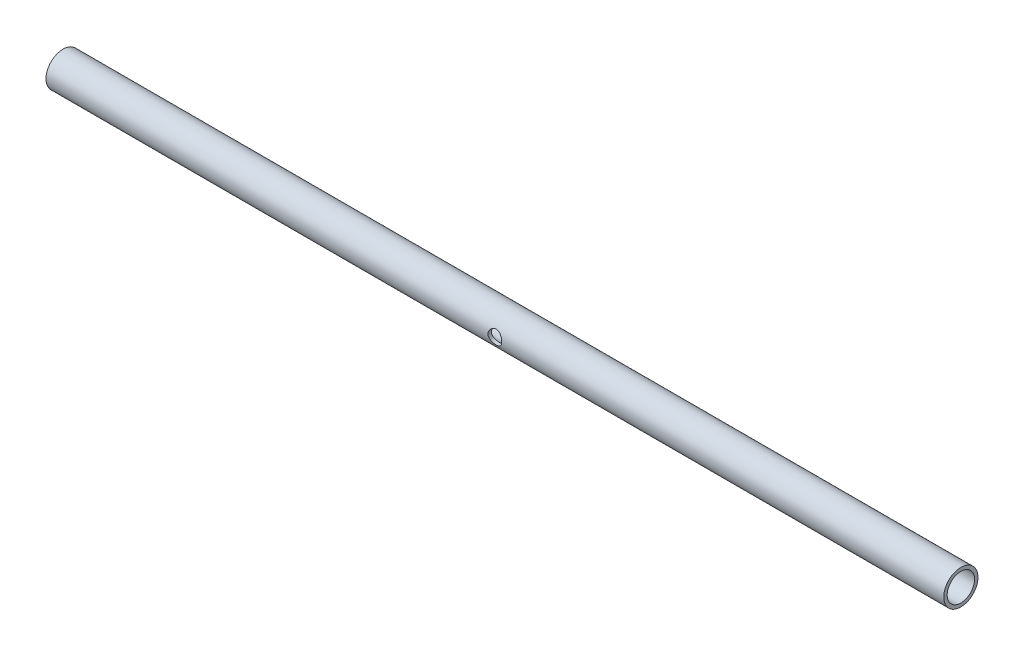
from build123d import *

# Parameters (mm, degrees)
SKETCH_1_R               = 5
SKETCH_1_R_2             = 4
EXTRUDE_1_DEPTH          = 131
CUT_EXTRUDE_1_DEPTH      = 132.19070089
CUT_EXTRUDE_1_DEPTH_BACK = 132.19070089
SKETCH_2_R               = 2


with BuildPart() as part:
    # 草圖1 → 填料-伸長1 (new, symmetric)
    with BuildSketch(Plane(origin=(0, 0, 0), x_dir=(0, 0, -1), z_dir=(1, 0, 0))):
        Circle(SKETCH_1_R)
        Circle(SKETCH_1_R_2, mode=Mode.SUBTRACT)
    extrude(amount=EXTRUDE_1_DEPTH, both=True)

    # 草圖2 → 除料-伸長1 (cut, two sides: drawn at the far end of the back side and taken through both)
    with BuildSketch(Plane.XY.offset(-CUT_EXTRUDE_1_DEPTH_BACK)):
        Circle(SKETCH_2_R)
    extrude(amount=CUT_EXTRUDE_1_DEPTH + CUT_EXTRUDE_1_DEPTH_BACK, mode=Mode.SUBTRACT)


solid = part.part
